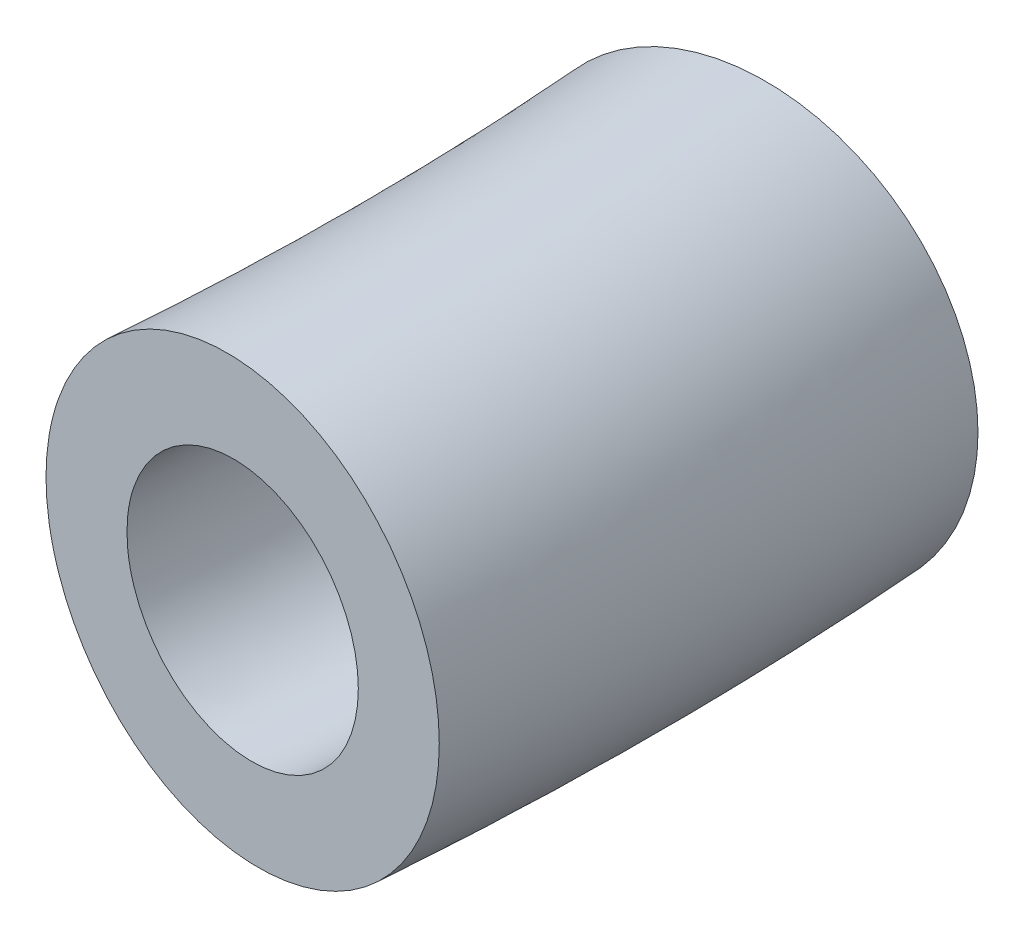
from build123d import *

# Parameters (mm, degrees)
SKETCH_1_R   = 42.5
SKETCH_1_R_2 = 25


with BuildPart() as part:
    # 扫描1: sweep along a path in 草图2
    with BuildLine() as sweep_1_path:  # in the path sketch's own coordinates; laid on its plane below (add() does not lay a ready-made edge on the line's plane)
        add(Edge.make_bspline(
            [(-2, 50), (2, 0), (-2, -50)],
            knots=[0, 0, 0, 1, 1, 1], degree=2))
    # 草图1 → 扫描1 (sweep)
    with BuildSketch(Plane.XY):
        Circle(SKETCH_1_R)
        Circle(SKETCH_1_R_2, mode=Mode.SUBTRACT)
    sweep(path=Plane(origin=(0, 0, 0), x_dir=(1, 0, 0), z_dir=(0, 1, 0)) * sweep_1_path.line)


solid = part.part
